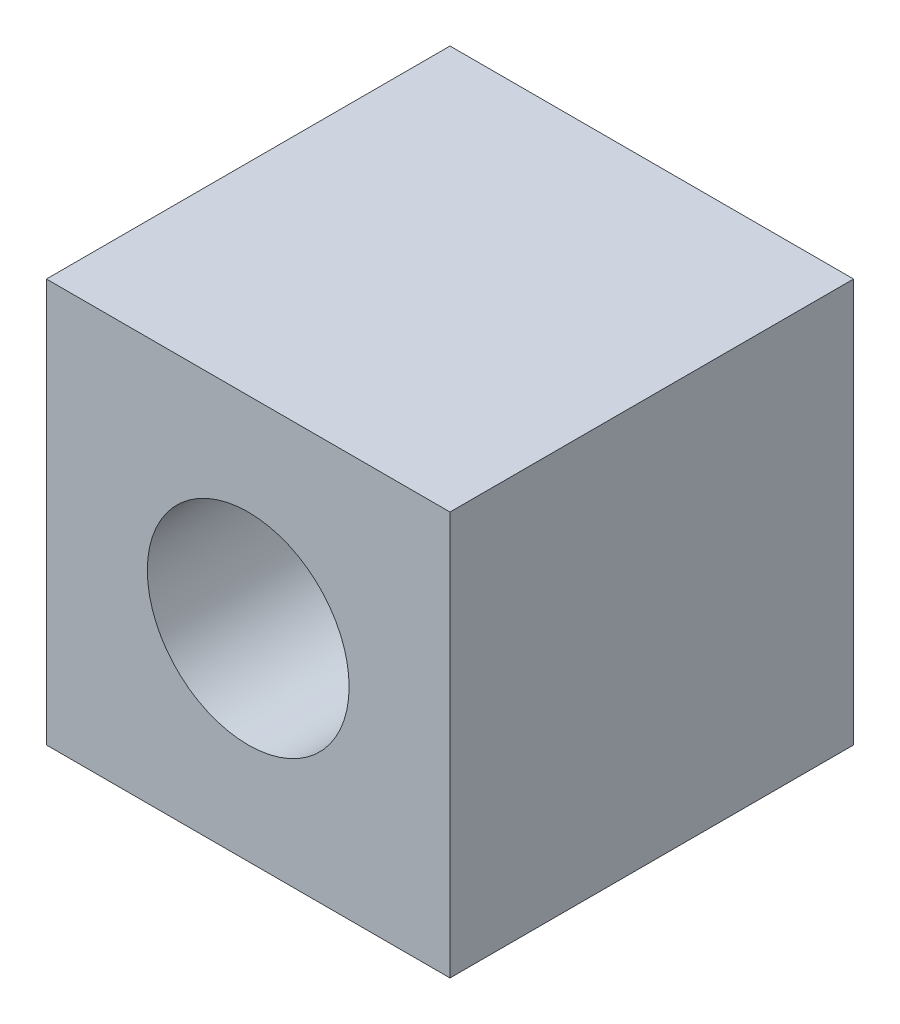
from build123d import *

# Parameters (mm, degrees)
SKETCH1_W           = 10
SKETCH1_H           = 10
BOSS_EXTRUDE1_DEPTH = 10
SKETCH2_R           = 2.5
CUT_EXTRUDE1_DEPTH  = 18.320508076


with BuildPart() as part:
    # Sketch1 → Boss-Extrude1 (new body)
    with BuildSketch(Plane.XY):
        with Locations((5, 5)):
            Rectangle(SKETCH1_W, SKETCH1_H)
    extrude(amount=BOSS_EXTRUDE1_DEPTH)

    # Sketch2 → Cut-Extrude1 (cut, through all)
    with BuildSketch(Plane.XY):
        with Locations((5, 5)):
            Circle(SKETCH2_R)
    extrude(amount=CUT_EXTRUDE1_DEPTH, mode=Mode.SUBTRACT)


solid = part.part
